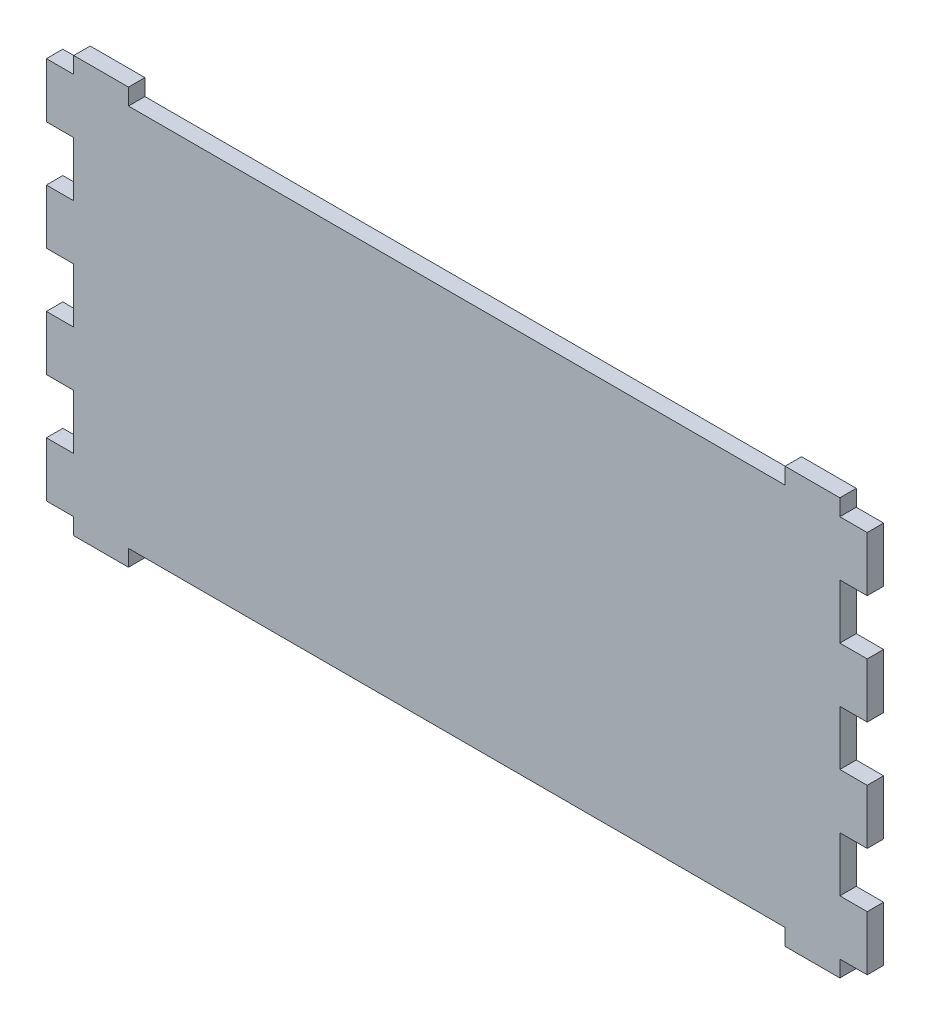
from build123d import *

# Parameters (mm, degrees)
ESBO_O1_W                = 10
ESBO_O1_H                = 3
ESBO_O1_W_2              = 140
ESBO_O1_H_2              = 70
RESSALTO_EXTRUS_O1_DEPTH = 3
ESBO_O2_W                = 5
ESBO_O2_H                = 10
RESSALTO_EXTRUS_O2_DEPTH = 3


with BuildPart() as part:
    # Esboço1 → Ressalto-extrusão1 (new body)
    with BuildSketch(Plane.XY):
        with Locations((-65, 36.5)):
            Rectangle(ESBO_O1_W, ESBO_O1_H)
        with Locations((65, -36.5)):
            Rectangle(ESBO_O1_W, ESBO_O1_H)
        with Locations((-65, -36.5)):
            Rectangle(ESBO_O1_W, ESBO_O1_H)
        Rectangle(ESBO_O1_W_2, ESBO_O1_H_2)
        with Locations((65, 36.5)):
            Rectangle(ESBO_O1_W, ESBO_O1_H)
    extrude(amount=RESSALTO_EXTRUS_O1_DEPTH)

    # Esboço2 → Ressalto-extrusão2 (add)
    with BuildSketch(Plane.XY.offset(3)):
        with Locations((-72.5, -30)):
            Rectangle(ESBO_O2_W, ESBO_O2_H)
        with Locations((-72.5, -10)):
            Rectangle(ESBO_O2_W, ESBO_O2_H)
        with Locations((-72.5, 10)):
            Rectangle(ESBO_O2_W, ESBO_O2_H)
        with Locations((-72.5, 30)):
            Rectangle(ESBO_O2_W, ESBO_O2_H)
        with Locations((72.5, 30)):
            Rectangle(ESBO_O2_W, ESBO_O2_H)
        with Locations((72.5, 10)):
            Rectangle(ESBO_O2_W, ESBO_O2_H)
        with Locations((72.5, -10)):
            Rectangle(ESBO_O2_W, ESBO_O2_H)
        with Locations((72.5, -30)):
            Rectangle(ESBO_O2_W, ESBO_O2_H)
    extrude(amount=-RESSALTO_EXTRUS_O2_DEPTH)


solid = part.part
